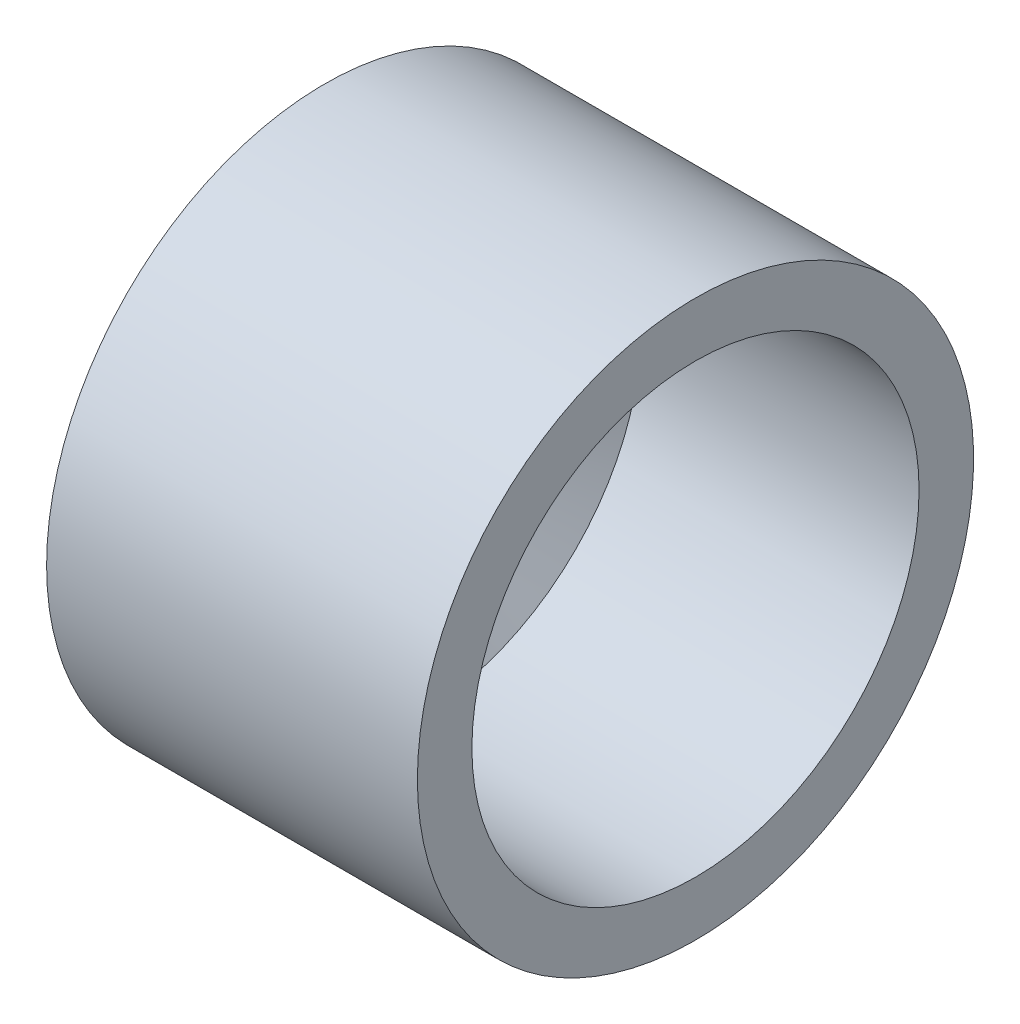
from build123d import *

# Parameters (mm, degrees)
CUT_EXTRUDE1_DEPTH               = 18.915104549
F_3_8_18_NPSM_TAPPED_HOLE1_D     = 15.3162
F_3_8_18_NPSM_TAPPED_HOLE1_DEPTH = 9.525
F_3_8_18_NPSM_TAPPED_HOLE1_TIP   = 4.601450707


with BuildPart() as part:
    # Sketch1 → Revolve1 (revolve)
    with BuildSketch(Plane.XY, mode=Mode.PRIVATE) as revolve1_sk:
        Polygon((0, 9.525), (12.7, 9.525), (12.7, 0), (0.889, 0), (0.889, 8.255), (0, 8.255), align=None)
    revolve(revolve1_sk.sketch.rotate(Axis((0, 0, 0), (1, 0, 0)), 90), axis=Axis((0, 0, 0), (1, 0, 0)))

    # Sketch2 → Cut-Extrude1 (cut, through all)
    with BuildSketch(Plane.ZY.offset(-0.889)):
        with BuildLine():
            Line((-4.7625, -2.54), (-4.7625, 2.54))
            ThreePointArc((-4.7625, 2.54), (0, 7.3025), (4.7625, 2.54))
            Line((4.7625, 2.54), (4.7625, -2.54))
            ThreePointArc((4.7625, -2.54), (0, -7.3025), (-4.7625, -2.54))
        make_face()
    extrude(amount=-CUT_EXTRUDE1_DEPTH, mode=Mode.SUBTRACT)

    # 3/8-18 NPSM Tapped Hole1
    with Locations(Plane(origin=(12.7, 0, 0), x_dir=(0, 0, -1), z_dir=(1, 0, 0))):
        with Locations((0, 0)):
            Hole(F_3_8_18_NPSM_TAPPED_HOLE1_D / 2, depth=F_3_8_18_NPSM_TAPPED_HOLE1_DEPTH)
            with Locations((0, 0, -(F_3_8_18_NPSM_TAPPED_HOLE1_DEPTH + F_3_8_18_NPSM_TAPPED_HOLE1_TIP / 2))):  # 118° drill point
                Cone(0, F_3_8_18_NPSM_TAPPED_HOLE1_D / 2, F_3_8_18_NPSM_TAPPED_HOLE1_TIP, mode=Mode.SUBTRACT)


solid = part.part
